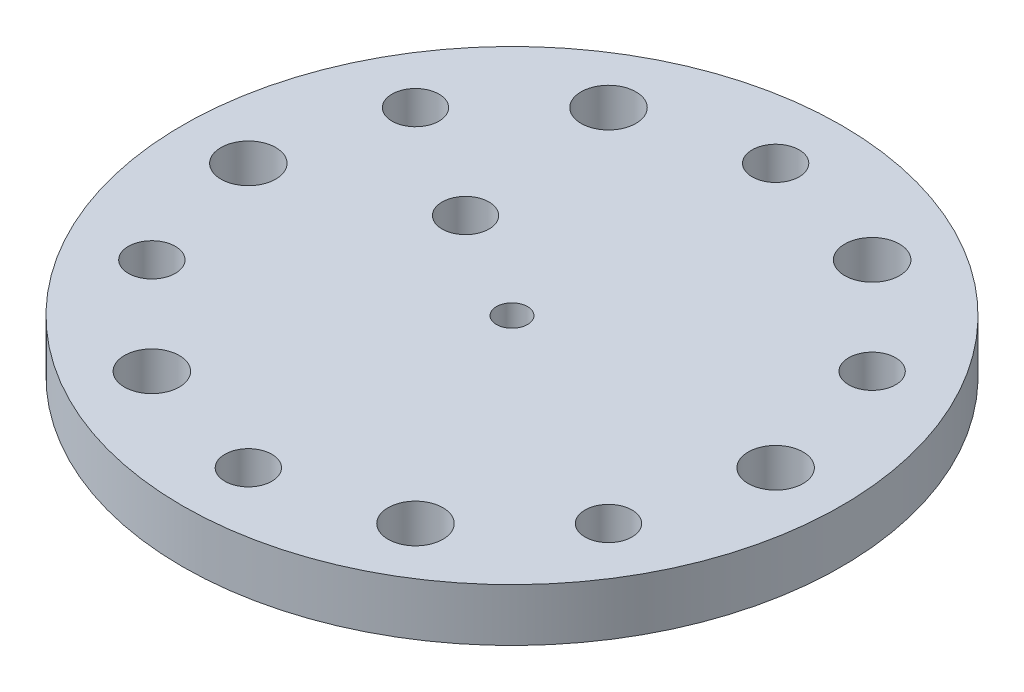
from build123d import *

# Parameters (mm, degrees)
SKETCH1_R                 = 15.875
BOSS_EXTRUDE1_DEPTH       = 2.54
TAP_DRILL_FOR_4_40_TAP1_D = 2.2606
CIRPATTERN1_COUNT         = 6
SKETCH8_R                 = 0.7493
CUT_EXTRUDE1_DEPTH        = 2.54
SKETCH15_R                = 1.3208
CUT_EXTRUDE2_DEPTH        = 2.54
CIRPATTERN2_COUNT         = 6
F_4_40_TAPPED_HOLE3_D     = 2.2606


with BuildPart() as part:
    # Sketch1 → Boss-Extrude1 (new body)
    with BuildSketch(Plane(origin=(0, 0, 0), x_dir=(1, 0, 0), z_dir=(0, 1, 0))):
        with Locations(Location((0, 0, 0), (0, 0, 270))):
            Circle(SKETCH1_R)
    extrude(amount=BOSS_EXTRUDE1_DEPTH)

    # Tap Drill for #4-40 Tap1 (through all)
    with Locations(Plane(origin=(0, 2.54, 0), x_dir=(1, 0, 0), z_dir=(0, 1, 0))):
        with Locations((0, 12.7)):
            tap_drill_for_4_40_tap1 = Hole(TAP_DRILL_FOR_4_40_TAP1_D / 2)

    # CirPattern1: Tap Drill for #4-40 Tap1 ×6 about axis
    cirpattern1_axis = Axis((0, 0, 0), (0, 1, 0))
    for i in range(1, CIRPATTERN1_COUNT):
        add(tap_drill_for_4_40_tap1.rotate(cirpattern1_axis, i * 360 / CIRPATTERN1_COUNT), mode=Mode.SUBTRACT)

    # Sketch8 → Cut-Extrude1 (cut)
    with BuildSketch(Plane(origin=(0, 2.54, 0), x_dir=(1, 0, 0), z_dir=(0, 1, 0))):
        with Locations(Location((0, 0, 0), (0, 0, 270))):
            Circle(SKETCH8_R)
    extrude(amount=-CUT_EXTRUDE1_DEPTH, mode=Mode.SUBTRACT)

    # Sketch15 → Cut-Extrude2 (cut)
    with BuildSketch(Plane(origin=(0, 2.54, 0), x_dir=(1, 0, 0), z_dir=(0, 1, 0))):
        with Locations(Location((12.7, 0, 0), (0, 0, 270))):
            Circle(SKETCH15_R)
    cut_extrude2 = extrude(amount=-CUT_EXTRUDE2_DEPTH, mode=Mode.SUBTRACT)

    # CirPattern2: Cut-Extrude2 ×6 about axis
    cirpattern2_axis = Axis((0, 0, 0), (0, 1, 0))
    for i in range(1, CIRPATTERN2_COUNT):
        add(cut_extrude2.rotate(cirpattern2_axis, i * 360 / CIRPATTERN2_COUNT), mode=Mode.SUBTRACT)

    # #4-40 Tapped Hole3 (through all)
    with Locations(Plane(origin=(0, 2.54, 0), x_dir=(1, 0, 0), z_dir=(0, 1, 0))):
        with Locations((-5.291415217, 3.055)):
            Hole(F_4_40_TAPPED_HOLE3_D / 2)


solid = part.part
